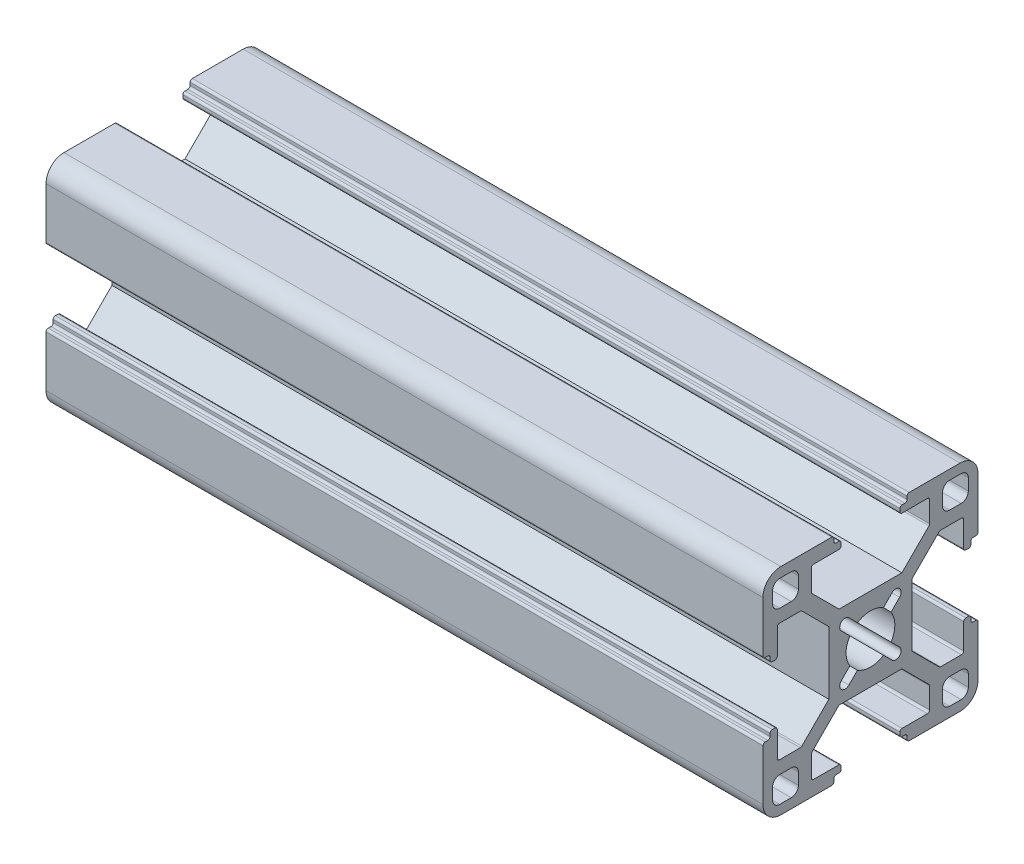
from build123d import *

# Parameters (mm, degrees)
SKETCH2_W                = 30
SKETCH2_H                = 30
BOSS_EXTRUDE1_DEPTH      = 100
SKETCH5_R                = 3.4
CUT_EXTRUDE2_DEPTH       = 103.225241501
CUT_EXTRUDE1_DEPTH       = 103.225241501
FILLET1_R                = 2.5
FILLET2_R                = 0.3
CIRPATTERN1_COUNT        = 4
FILLET1_OF_CIRPATTERN1_R = 2.5
FILLET2_OF_CIRPATTERN1_R = 0.3


with BuildPart() as part:
    # Sketch2 → Boss-Extrude1 (new body)
    with BuildSketch(Plane(origin=(0, 0, 0), x_dir=(0, 0, -1), z_dir=(1, 0, 0))):
        Rectangle(SKETCH2_W, SKETCH2_H)
    extrude(amount=BOSS_EXTRUDE1_DEPTH)

    # Sketch5 → Cut-Extrude2 (cut, through all)
    with BuildSketch(Plane(origin=(100, 0, 0), x_dir=(0, 0, -1), z_dir=(1, 0, 0))):
        Circle(SKETCH5_R)
    extrude(amount=-CUT_EXTRUDE2_DEPTH, mode=Mode.SUBTRACT)

    # Sketch4 → Cut-Extrude1 (cut, through all)
    with BuildSketch(Plane(origin=(100, 0, 0), x_dir=(0, 0, -1), z_dir=(1, 0, 0))):
        with BuildLine():
            Line((-4.385786454, -5.8), (4.385786454, -5.8))
            Line((4.385786454, -5.8), (8.162132034, -9.57634558))
            ThreePointArc((8.162132034, -9.57634558), (8.22716386, -9.673672585), (8.25, -9.788477614))
            Line((8.25, -9.788477614), (8.25, -13))
            Line((8.25, -13), (4.1, -13))
            Line((4.1, -13), (4.1, -14))
            Line((4.1, -14), (5.1, -14))
            Line((5.1, -14), (5.1, -15))
            Line((5.1, -15), (-5.1, -15))
            Line((-5.1, -15), (-5.1, -14))
            Line((-5.1, -14), (-4.1, -14))
            Line((-4.1, -14), (-4.1, -13))
            Line((-4.1, -13), (-8.25, -13))
            Line((-8.25, -13), (-8.25, -9.788477614))
            ThreePointArc((-8.25, -9.788477614), (-8.22716386, -9.673672585), (-8.162132034, -9.57634558))
            Line((-8.162132034, -9.57634558), (-4.385786454, -5.8))
        make_face()
        with BuildLine():
            Line((11.05, -10.05), (12.65, -10.05))
            ThreePointArc((12.65, -10.05), (13.357106781, -10.342893219), (13.65, -11.05))
            Line((13.65, -11.05), (13.65, -12.65))
            ThreePointArc((13.65, -12.65), (13.357106781, -13.357106781), (12.65, -13.65))
            Line((12.65, -13.65), (11.05, -13.65))
            ThreePointArc((11.05, -13.65), (10.342893219, -13.357106781), (10.05, -12.65))
            Line((10.05, -12.65), (10.05, -11.05))
            ThreePointArc((10.05, -11.05), (10.342893219, -10.342893219), (11.05, -10.05))
        make_face()
        with BuildLine():
            Line((4.065863992, -3.00520382), (2.87527145, -1.814611278))
            ThreePointArc((2.87527145, -1.814611278), (2.404163056, -2.404163056), (1.814611278, -2.87527145))
            Line((1.814611278, -2.87527145), (3.00520382, -4.065863992))
            ThreePointArc((3.00520382, -4.065863992), (4.065863992, -4.065863992), (4.065863992, -3.00520382))
        make_face()
    cut_extrude1 = extrude(amount=-CUT_EXTRUDE1_DEPTH, mode=Mode.SUBTRACT)

    # Fillet1
    fillet1_edges = [part.edges().sort_by_distance(p)[0] for p in [
        (50, -15, -15),
    ]]
    fillet(fillet1_edges, radius=FILLET1_R)

    # Fillet2
    fillet2_edges = [part.edges().sort_by_distance(p)[0] for p in [
        (50, -14, -5.1),
        (50, -15, -5.1),
        (50, -14, -4.1),
        (50, -13, -4.1),
        (50, -13, -8.25),
        (50, -13, 8.25),
        (50, -13, 4.1),
        (50, -14, 4.1),
        (50, -14, 5.1),
        (50, -15, 5.1),
    ]]
    fillet(fillet2_edges, radius=FILLET2_R)

    # CirPattern1: Cut-Extrude1 ×4 about axis
    cirpattern1_axis = Axis((0, 0, 0), (1, 0, 0))
    for i in range(1, CIRPATTERN1_COUNT):
        add(cut_extrude1.rotate(cirpattern1_axis, i * 360 / CIRPATTERN1_COUNT), mode=Mode.SUBTRACT)

    # Fillet1 of CirPattern1
    fillet1_of_cirpattern1_edges = [part.edges().sort_by_distance(p)[0] for p in [
        (50, 15, -15),
        (50, 15, 15),
        (50, -15, 15),
    ]]
    fillet(fillet1_of_cirpattern1_edges, radius=FILLET1_OF_CIRPATTERN1_R)

    # Fillet2 of CirPattern1
    fillet2_of_cirpattern1_edges = [part.edges().sort_by_distance(p)[0] for p in [
        (50, 5.1, -14),
        (50, 5.1, -15),
        (50, 4.1, -14),
        (50, 4.1, -13),
        (50, 8.25, -13),
        (50, -8.25, -13),
        (50, -4.1, -13),
        (50, -4.1, -14),
        (50, -5.1, -14),
        (50, -5.1, -15),
        (50, 14, 5.1),
        (50, 15, 5.1),
        (50, 14, 4.1),
        (50, 13, 4.1),
        (50, 13, 8.25),
        (50, 13, -8.25),
        (50, 13, -4.1),
        (50, 14, -4.1),
        (50, 14, -5.1),
        (50, 15, -5.1),
        (50, -5.1, 14),
        (50, -5.1, 15),
        (50, -4.1, 14),
        (50, -4.1, 13),
        (50, -8.25, 13),
        (50, 8.25, 13),
        (50, 4.1, 13),
        (50, 4.1, 14),
        (50, 5.1, 14),
        (50, 5.1, 15),
    ]]
    fillet(fillet2_of_cirpattern1_edges, radius=FILLET2_OF_CIRPATTERN1_R)


solid = part.part
